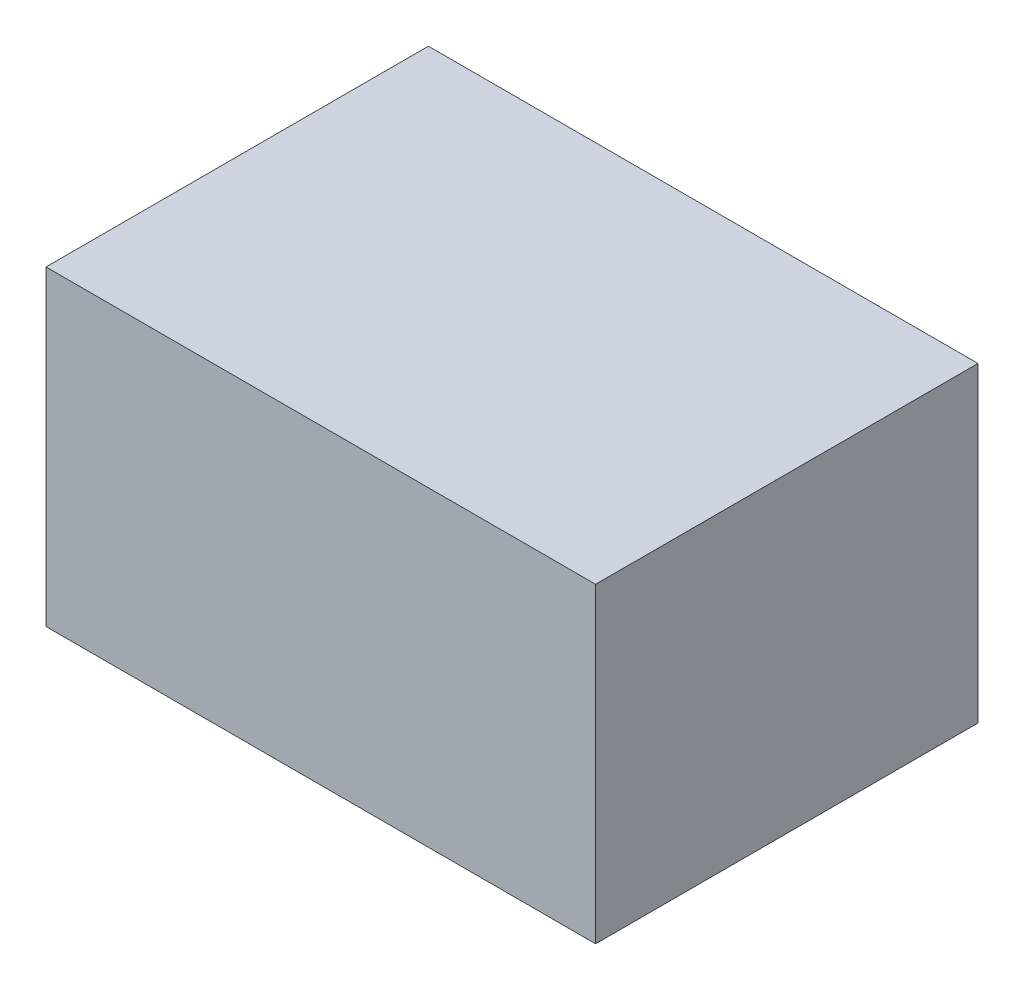
from build123d import *

# Parameters (mm, degrees)
SKIZZE1_W                       = 503
SKIZZE1_H                       = 285
AUFSATZ_LINEAR_AUSTRAGEN1_DEPTH = 350
SKIZZE2_R                       = 19
AUFSATZ_LINEAR_AUSTRAGEN2_DEPTH = 25


with BuildPart() as part:
    # Skizze1 → Aufsatz-Linear austragen1 (new body)
    with BuildSketch(Plane.XY):
        with Locations((251.5, 142.5)):
            Rectangle(SKIZZE1_W, SKIZZE1_H)
    extrude(amount=AUFSATZ_LINEAR_AUSTRAGEN1_DEPTH)

    # Skizze2 → Aufsatz-Linear austragen2 (add)
    with BuildSketch(Plane.XZ):
        with Locations(Location((84.399565915, 294.555551984, 0), (0, 0, 90))):
            Circle(SKIZZE2_R)
        with Locations(Location((403.747062166, 294.555551984, 0), (0, 0, 90))):
            Circle(SKIZZE2_R)
        with Locations(Location((403.747062166, 75.47123017, 0), (0, 0, 90))):
            Circle(SKIZZE2_R)
        with Locations(Location((84.399565915, 75.47123017, 0), (0, 0, 90))):
            Circle(SKIZZE2_R)
    extrude(amount=AUFSATZ_LINEAR_AUSTRAGEN2_DEPTH)


solid = part.part
